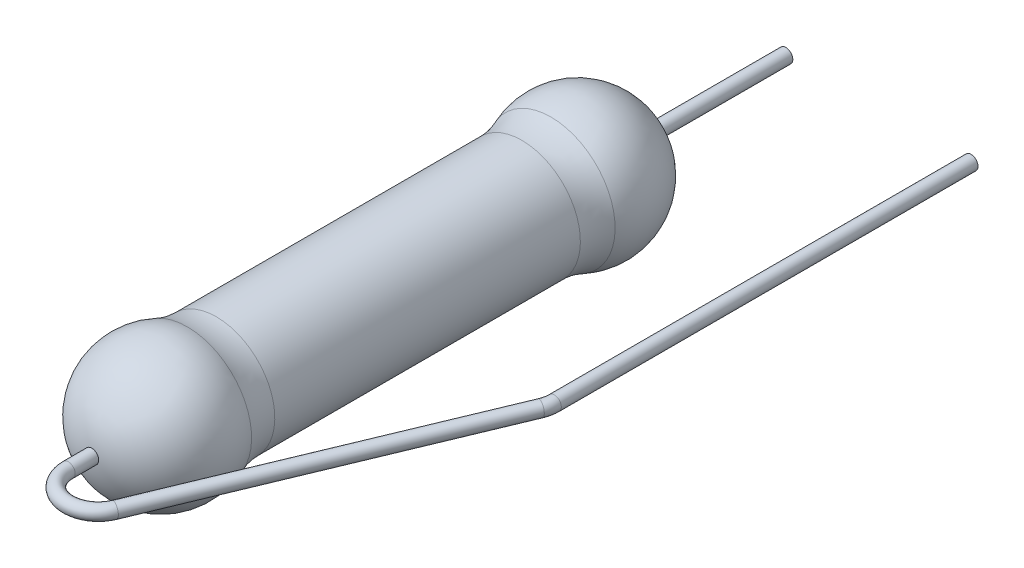
from build123d import *

# Parameters (mm, degrees)
BOSS_EXTRUDE2_DEPTH      = 1
BOSS_EXTRUDE2_DEPTH_BACK = 2
SKETCH1_R                = 0.15
SKETCH5_R                = 0.15
BOSS_EXTRUDE3_DEPTH      = 0.5
BOSS_EXTRUDE4_DEPTH      = 7
BOSS_EXTRUDE4_DEPTH_BACK = 2
SKETCH6_R                = 0.15
SKETCH16_R               = 0.15


with BuildPart() as part:
    # Sketch1 → Boss-Extrude2 (new, two sides: drawn at the far end of the back side and taken through both)
    with BuildSketch(Plane.XY.offset(-BOSS_EXTRUDE2_DEPTH_BACK)):
        Circle(SKETCH1_R)
    extrude(amount=BOSS_EXTRUDE2_DEPTH + BOSS_EXTRUDE2_DEPTH_BACK)

    # Sketch4 → Revolve2 (revolve)
    with BuildSketch(Plane(origin=(0, 0, 0), x_dir=(0, 0, -1), z_dir=(1, 0, 0))):
        with BuildLine():
            ThreePointArc((-3.699926528, 1.261319774), (-3.380844772, 1.292746584), (-3.074025149, 1.385819299))
            ThreePointArc((-3.074025149, 1.385819299), (-1.730128131, 1.287360597), (-1.007518844, 0.15))
            Line((-1.007518844, 0.15), (-1, 0.15))
            Line((-1, 0.15), (-1, 0))
            Line((-1, 0), (-2.5, 0))
            Line((-2.5, 0), (-4, 0))
            Line((-4, 0), (-11.5, 0))
            Line((-11.5, 0), (-13, 0))
            Line((-13, 0), (-13, 0.15))
            Line((-13, 0.15), (-12.992481156, 0.15))
            ThreePointArc((-12.992481156, 0.15), (-12.269871869, 1.287360597), (-10.925974851, 1.385819299))
            ThreePointArc((-10.925974851, 1.385819299), (-10.619155228, 1.292746584), (-10.300073472, 1.261319774))
            Line((-10.300073472, 1.261319774), (-3.699926528, 1.261319774))
        make_face()
    revolve(axis=Axis((0, 0, 4), (0, 0, 1)))

    # Sketch5 → Boss-Extrude3 (add)
    with BuildSketch(Plane.XY.offset(13)):
        Circle(SKETCH5_R)
    extrude(amount=BOSS_EXTRUDE3_DEPTH)



with BuildPart() as body_2:
    # Sketch6 → Boss-Extrude4 (new, two sides: drawn at the far end of the back side and taken through both)
    with BuildSketch(Plane.XY.offset(-BOSS_EXTRUDE4_DEPTH_BACK)):
        with Locations((4, 0)):
            Circle(SKETCH6_R)
    extrude(amount=BOSS_EXTRUDE4_DEPTH + BOSS_EXTRUDE4_DEPTH_BACK)


with BuildPart() as part_1:
    add(part.part)

    add(body_2.part)  # Sweep3 merges body 2
    # Sweep3: sweep along a path in Sketch7
    with BuildLine(Plane(origin=(0, 0, 0), x_dir=(1, 0, 0), z_dir=(0, 1, 0))) as sweep3_path:
        ThreePointArc((4.15, -7), (4.134550157, -7.156464216), (4.088797373, -7.306885063))
        Line((4.088797373, -7.306885063), (1.388797373, -13.806885063))
        ThreePointArc((1.388797373, -13.806885063), (0.493535784, -14.284550157), (-0.15, -13.5))
    # Sketch16 → Sweep3 (sweep)
    with BuildSketch(Plane.XY.offset(7)):
        with Locations((4, 0)):
            Circle(SKETCH16_R)
    sweep(path=sweep3_path.line)


solid = part_1.part
